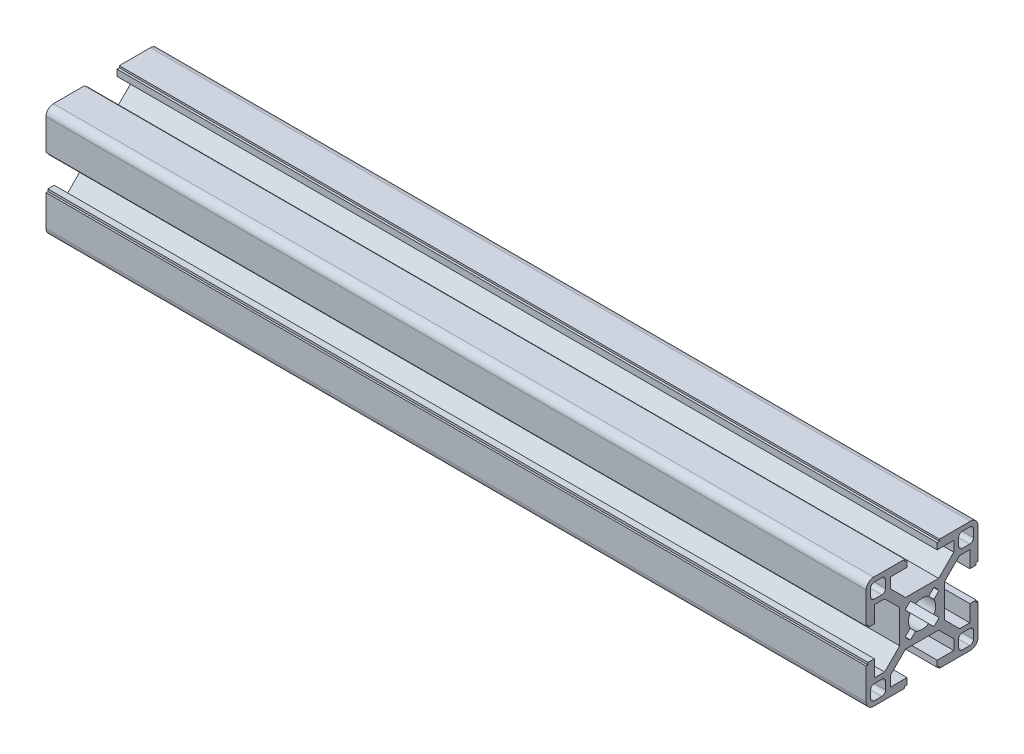
from build123d import *

# Parameters (mm, degrees)
AUFSATZ_LINEAR_AUSTRAGEN1_DEPTH = 220


with BuildPart() as part:
    # Skizze1 → Aufsatz-Linear austragen1 (new body)
    with BuildSketch(Plane(origin=(0, 0, 0), x_dir=(0, 0, -1), z_dir=(1, 0, 0))):
        with BuildLine():
            Line((10.055634919, 8.5), (12.8, 8.5))
            Line((12.8, 8.5), (12.8, 4.05))
            Line((12.8, 4.05), (14.5, 4.05))
            Line((14.5, 4.05), (14.5, 4.651637069))
            Line((14.5, 4.651637069), (15, 4.651637069))
            Line((15, 4.651637069), (15, 13))
            ThreePointArc((15, 13), (14.414213562, 14.414213562), (13, 15))
            Line((13, 15), (4.651637069, 15))
            Line((4.651637069, 15), (4.651637069, 14.5))
            Line((4.651637069, 14.5), (4.05, 14.5))
            Line((4.05, 14.5), (4.05, 12.8))
            Line((4.05, 12.8), (8.5, 12.8))
            Line((8.5, 12.8), (8.5, 10.055634919))
            Line((8.5, 10.055634919), (4.444365081, 6))
            Line((4.444365081, 6), (-4.444365081, 6))
            Line((-4.444365081, 6), (-8.5, 10.055634919))
            Line((-8.5, 10.055634919), (-8.5, 12.8))
            Line((-8.5, 12.8), (-4.05, 12.8))
            Line((-4.05, 12.8), (-4.05, 14.5))
            Line((-4.05, 14.5), (-4.651637069, 14.5))
            Line((-4.651637069, 14.5), (-4.651637069, 15))
            Line((-4.651637069, 15), (-13, 15))
            ThreePointArc((-13, 15), (-14.414213562, 14.414213562), (-15, 13))
            Line((-15, 13), (-15, 4.651637069))
            Line((-15, 4.651637069), (-14.5, 4.651637069))
            Line((-14.5, 4.651637069), (-14.5, 4.05))
            Line((-14.5, 4.05), (-12.8, 4.05))
            Line((-12.8, 4.05), (-12.8, 8.5))
            Line((-12.8, 8.5), (-10.055634919, 8.5))
            Line((-10.055634919, 8.5), (-6, 4.444365081))
            Line((-6, 4.444365081), (-6, -4.444365081))
            Line((-6, -4.444365081), (-10.055634919, -8.5))
            Line((-10.055634919, -8.5), (-12.8, -8.5))
            Line((-12.8, -8.5), (-12.8, -4.05))
            Line((-12.8, -4.05), (-14.5, -4.05))
            Line((-14.5, -4.05), (-14.5, -4.651637069))
            Line((-14.5, -4.651637069), (-15, -4.651637069))
            Line((-15, -4.651637069), (-15, -13))
            ThreePointArc((-15, -13), (-14.414213562, -14.414213562), (-13, -15))
            Line((-13, -15), (-4.651637069, -15))
            Line((-4.651637069, -15), (-4.651637069, -14.5))
            Line((-4.651637069, -14.5), (-4.05, -14.5))
            Line((-4.05, -14.5), (-4.05, -12.8))
            Line((-4.05, -12.8), (-8.5, -12.8))
            Line((-8.5, -12.8), (-8.5, -10.055634919))
            Line((-8.5, -10.055634919), (-4.444365081, -6))
            Line((-4.444365081, -6), (4.444365081, -6))
            Line((4.444365081, -6), (8.5, -10.055634919))
            Line((8.5, -10.055634919), (8.5, -12.8))
            Line((8.5, -12.8), (4.05, -12.8))
            Line((4.05, -12.8), (4.05, -14.5))
            Line((4.05, -14.5), (4.651637069, -14.5))
            Line((4.651637069, -14.5), (4.651637069, -15))
            Line((4.651637069, -15), (13, -15))
            ThreePointArc((13, -15), (14.414213562, -14.414213562), (15, -13))
            Line((15, -13), (15, -4.651637069))
            Line((15, -4.651637069), (14.5, -4.651637069))
            Line((14.5, -4.651637069), (14.5, -4.05))
            Line((14.5, -4.05), (12.8, -4.05))
            Line((12.8, -4.05), (12.8, -8.5))
            Line((12.8, -8.5), (10.055634919, -8.5))
            Line((10.055634919, -8.5), (6, -4.444365081))
            Line((6, -4.444365081), (6, 4.444365081))
            Line((6, 4.444365081), (10.055634919, 8.5))
        make_face()
        with BuildLine():
            ThreePointArc((12.8, 13.8), (13.507106781, 13.507106781), (13.8, 12.8))
            Line((13.8, 12.8), (13.8, 10.8))
            ThreePointArc((13.8, 10.8), (13.507106781, 10.092893219), (12.8, 9.8))
            Line((12.8, 9.8), (10.8, 9.8))
            ThreePointArc((10.8, 9.8), (10.092893219, 10.092893219), (9.8, 10.8))
            Line((9.8, 10.8), (9.8, 12.8))
            ThreePointArc((9.8, 12.8), (10.092893219, 13.507106781), (10.8, 13.8))
            Line((10.8, 13.8), (12.8, 13.8))
        make_face(mode=Mode.SUBTRACT)
        with BuildLine():
            Line((-3.117157854, 4.531371416), (-1.775079755, 3.189293317))
            ThreePointArc((-1.775079755, 3.189293317), (0, 3.65), (1.775079755, 3.189293317))
            Line((1.775079755, 3.189293317), (3.117157854, 4.531371416))
            ThreePointArc((3.117157854, 4.531371416), (3.889087297, 3.889087297), (4.531371416, 3.117157854))
            Line((4.531371416, 3.117157854), (3.189293317, 1.775079755))
            ThreePointArc((3.189293317, 1.775079755), (3.65, 0), (3.189293317, -1.775079755))
            Line((3.189293317, -1.775079755), (4.531371416, -3.117157854))
            ThreePointArc((4.531371416, -3.117157854), (3.889087297, -3.889087297), (3.117157854, -4.531371416))
            Line((3.117157854, -4.531371416), (1.775079755, -3.189293317))
            ThreePointArc((1.775079755, -3.189293317), (0, -3.65), (-1.775079755, -3.189293317))
            Line((-1.775079755, -3.189293317), (-3.117157854, -4.531371416))
            ThreePointArc((-3.117157854, -4.531371416), (-3.889087297, -3.889087297), (-4.531371416, -3.117157854))
            Line((-4.531371416, -3.117157854), (-3.189293317, -1.775079755))
            ThreePointArc((-3.189293317, -1.775079755), (-3.65, 0), (-3.189293317, 1.775079755))
            Line((-3.189293317, 1.775079755), (-4.531371416, 3.117157854))
            ThreePointArc((-4.531371416, 3.117157854), (-3.889087297, 3.889087297), (-3.117157854, 4.531371416))
        make_face(mode=Mode.SUBTRACT)
        with BuildLine():
            ThreePointArc((-13.8, 12.8), (-13.507106781, 13.507106781), (-12.8, 13.8))
            Line((-12.8, 13.8), (-10.8, 13.8))
            ThreePointArc((-10.8, 13.8), (-10.092893219, 13.507106781), (-9.8, 12.8))
            Line((-9.8, 12.8), (-9.8, 10.8))
            ThreePointArc((-9.8, 10.8), (-10.092893219, 10.092893219), (-10.8, 9.8))
            Line((-10.8, 9.8), (-12.8, 9.8))
            ThreePointArc((-12.8, 9.8), (-13.507106781, 10.092893219), (-13.8, 10.8))
            Line((-13.8, 10.8), (-13.8, 12.8))
        make_face(mode=Mode.SUBTRACT)
        with BuildLine():
            ThreePointArc((9.8, -10.8), (10.092893219, -10.092893219), (10.8, -9.8))
            Line((10.8, -9.8), (12.8, -9.8))
            ThreePointArc((12.8, -9.8), (13.507106781, -10.092893219), (13.8, -10.8))
            Line((13.8, -10.8), (13.8, -12.8))
            ThreePointArc((13.8, -12.8), (13.507106781, -13.507106781), (12.8, -13.8))
            Line((12.8, -13.8), (10.8, -13.8))
            ThreePointArc((10.8, -13.8), (10.092893219, -13.507106781), (9.8, -12.8))
            Line((9.8, -12.8), (9.8, -10.8))
        make_face(mode=Mode.SUBTRACT)
        with BuildLine():
            Line((-9.8, -10.8), (-9.8, -12.8))
            ThreePointArc((-9.8, -12.8), (-10.092893219, -13.507106781), (-10.8, -13.8))
            Line((-10.8, -13.8), (-12.8, -13.8))
            ThreePointArc((-12.8, -13.8), (-13.507106781, -13.507106781), (-13.8, -12.8))
            Line((-13.8, -12.8), (-13.8, -10.8))
            ThreePointArc((-13.8, -10.8), (-13.507106781, -10.092893219), (-12.8, -9.8))
            Line((-12.8, -9.8), (-10.8, -9.8))
            ThreePointArc((-10.8, -9.8), (-10.092893219, -10.092893219), (-9.8, -10.8))
        make_face(mode=Mode.SUBTRACT)
    extrude(amount=AUFSATZ_LINEAR_AUSTRAGEN1_DEPTH)


solid = part.part
